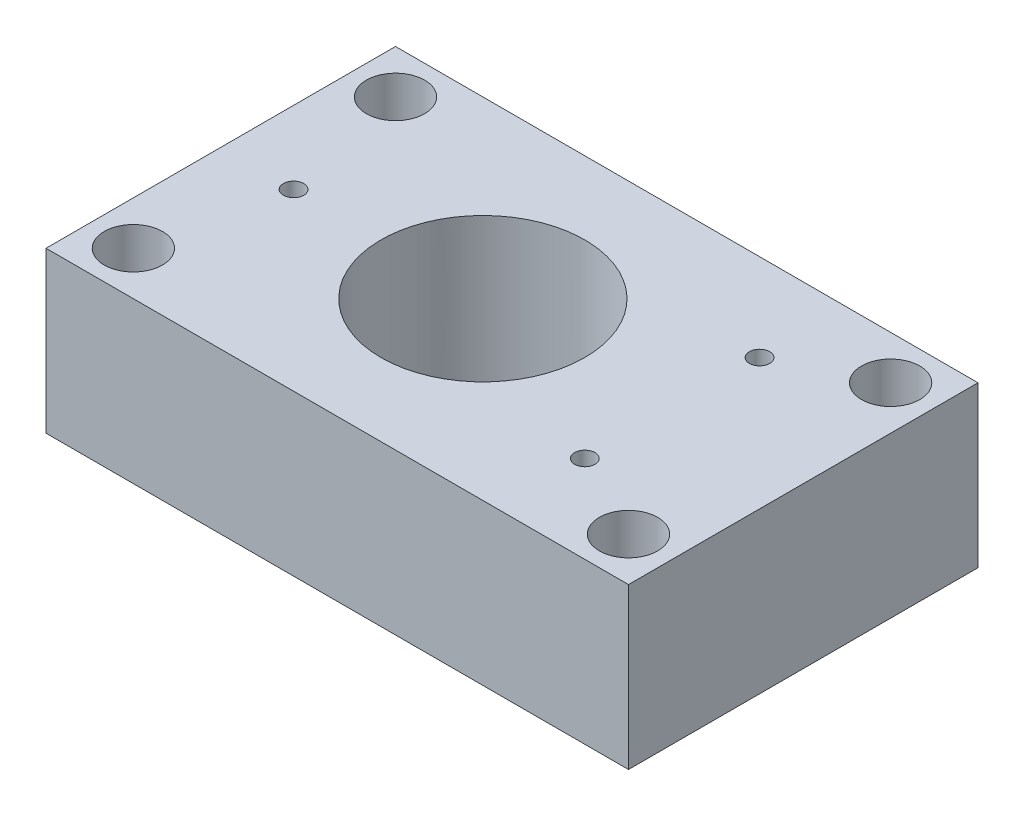
from build123d import *

# Parameters (mm, degrees)
SKETCH_1_W               = 20
SKETCH_1_H               = 12
SKETCH_1_R               = 3.5
EXTRUDE_1_DEPTH          = 5.5
SKETCH_1_17_R            = 2.65
CUT_EXTRUDE_8_DEPTH      = 1.6
CUT_EXTRUDE_3_DEPTH      = 24.963513933
CUT_EXTRUDE_3_DEPTH_BACK = 24.963513933
SKETCH_3_R               = 0.75
SKETCH_3_R_2             = 0.35
CUT_EXTRUDE_START        = 5.5
SKETCH_3_5_R             = 1
CUT_EXTRUDE_4_DEPTH      = 4.5


with BuildPart() as part:
    # 草图1 → 凸台-拉伸1 (new body)
    with BuildSketch(Plane(origin=(0, 0, 0), x_dir=(1, 0, 0), z_dir=(0, 1, 0))):
        with Locations((10, -6)):
            Rectangle(SKETCH_1_W, SKETCH_1_H)
        with Locations(Location((9, -6, 0), (0, 0, 270))):
            Circle(SKETCH_1_R, mode=Mode.SUBTRACT)
    extrude(amount=EXTRUDE_1_DEPTH)

    # 草图1<17> → 切除-拉伸8 (cut)
    with BuildSketch(Plane(origin=(0, 0, 0), x_dir=(1, 0, 0), z_dir=(0, 1, 0))):
        with Locations((15, -6)):
            Circle(SKETCH_1_17_R)
    extrude(amount=CUT_EXTRUDE_8_DEPTH, mode=Mode.SUBTRACT)

    # 草图3 → 切除-拉伸3 (cut, two sides: drawn at the far end of the back side and taken through both)
    with BuildSketch(Plane(origin=(0, 0, 0), x_dir=(1, 0, 0), z_dir=(0, 1, 0)).offset(-CUT_EXTRUDE_3_DEPTH_BACK)):
        with Locations(Location((1.5, -1.5, 0), (0, 0, 270))):
            Circle(SKETCH_3_R)
        with Locations(Location((18.5, -1.5, 0), (0, 0, 270))):
            Circle(SKETCH_3_R)
        with Locations(Location((1.5, -10.5, 0), (0, 0, 270))):
            Circle(SKETCH_3_R)
        with Locations(Location((18.5, -10.5, 0), (0, 0, 270))):
            Circle(SKETCH_3_R)
        with Locations(Location((15.5, -3, 0), (0, 0, 270))):
            Circle(SKETCH_3_R_2)
        with Locations(Location((2.5, -6, 0), (0, 0, 270))):
            Circle(SKETCH_3_R_2)
        with Locations(Location((15.5, -9, 0), (0, 0, 270))):
            Circle(SKETCH_3_R_2)
    extrude(amount=CUT_EXTRUDE_3_DEPTH + CUT_EXTRUDE_3_DEPTH_BACK, mode=Mode.SUBTRACT)

    # 草图3<5> → 切除-拉伸4 (cut)
    with BuildSketch(Plane(origin=(0, 0, 0), x_dir=(1, 0, 0), z_dir=(0, 1, 0)).offset(CUT_EXTRUDE_START)):
        with Locations(Location((1.5, -1.5, 0), (0, 0, 270))):
            Circle(SKETCH_3_5_R)
        with Locations(Location((18.5, -1.5, 0), (0, 0, 270))):
            Circle(SKETCH_3_5_R)
        with Locations(Location((18.5, -10.5, 0), (0, 0, 270))):
            Circle(SKETCH_3_5_R)
        with Locations(Location((1.5, -10.5, 0), (0, 0, 270))):
            Circle(SKETCH_3_5_R)
    extrude(amount=-CUT_EXTRUDE_4_DEPTH, mode=Mode.SUBTRACT)


solid = part.part
